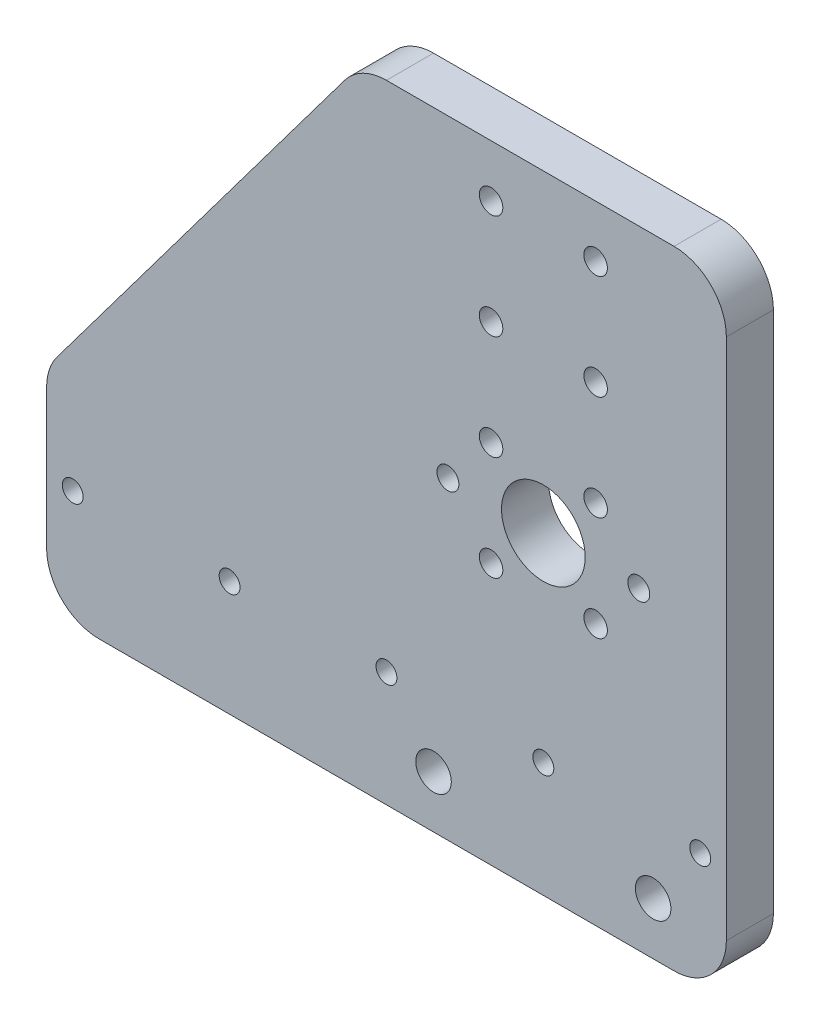
from build123d import *

# Parameters (mm, degrees)
BOSS_EXTRU_1_DEPTH      = 9
ESQUISSE2_R             = 2
ESQUISSE2_R_2           = 2.25
ENL_V_MAT_EXTRU_1_DEPTH = 178.146831753
ESQUISSE3_R             = 8
ESQUISSE3_R_2           = 3.4
ENL_V_MAT_EXTRU_2_DEPTH = 178.146831753
CONG_1_R                = 10
ESQUISSE6_R             = 2.1
ENL_V_MAT_EXTRU_4_DEPTH = 178.146831753


with BuildPart() as part:
    # Esquisse1 → Boss.-Extru.1 (new body)
    with BuildSketch(Plane.XY):
        Polygon((0, 0), (130, 0), (130, 120), (60, 120), (0, 40), align=None)
    extrude(amount=BOSS_EXTRU_1_DEPTH)

    # Esquisse2 → Enlèv. mat.-Extru.1 (cut, through all)
    with BuildSketch(Plane.XY.offset(9)):
        with Locations((65, 22)):
            Circle(ESQUISSE2_R)
        with Locations((35, 22)):
            Circle(ESQUISSE2_R)
        with Locations((5, 22)):
            Circle(ESQUISSE2_R)
        with Locations(Location((125, 22, 0), (0, 0, 180))):
            Circle(ESQUISSE2_R)
        with Locations(Location((95, 22, 0), (0, 0, 180))):
            Circle(ESQUISSE2_R)
        with Locations((85, 110)):
            Circle(ESQUISSE2_R_2)
        with Locations(Location((85, 90, 0), (0, 0, 180))):
            Circle(ESQUISSE2_R_2)
        with Locations((105, 90)):
            Circle(ESQUISSE2_R_2)
        with Locations(Location((105, 110, 0), (0, 0, 180))):
            Circle(ESQUISSE2_R_2)
        with Locations((105, 50)):
            Circle(ESQUISSE2_R_2)
        with Locations(Location((105, 70, 0), (0, 0, 180))):
            Circle(ESQUISSE2_R_2)
        with Locations((85, 70)):
            Circle(ESQUISSE2_R_2)
        with Locations(Location((85, 50, 0), (0, 0, 180))):
            Circle(ESQUISSE2_R_2)
    extrude(amount=-ENL_V_MAT_EXTRU_1_DEPTH, mode=Mode.SUBTRACT)

    # Esquisse3 → Enlèv. mat.-Extru.2 (cut, through all)
    with BuildSketch(Plane.XY.offset(9)):
        with Locations((95, 60)):
            Circle(ESQUISSE3_R)
        with Locations((74, 10)):
            Circle(ESQUISSE3_R_2)
        with Locations(Location((116, 10, 0), (0, 0, 180))):
            Circle(ESQUISSE3_R_2)
    extrude(amount=-ENL_V_MAT_EXTRU_2_DEPTH, mode=Mode.SUBTRACT)

    # Congé1
    cong_1_edges = [part.edges().sort_by_distance(p)[0] for p in [
        (0, 40, 4.5),
        (60, 120, 4.5),
        (130, 120, 4.5),
        (130, 0, 4.5),
        (0, 0, 4.5),
    ]]
    fillet(cong_1_edges, radius=CONG_1_R)

    # Esquisse6 → Enlèv. mat.-Extru.4 (cut, through all)
    with BuildSketch(Plane(origin=(0, 0, 0), x_dir=(-1, 0, 0), z_dir=(0, 0, -1))):
        with Locations((-113.25, 60)):
            Circle(ESQUISSE6_R)
        with Locations(Location((-76.75, 60, 0), (0, 0, 180))):
            Circle(ESQUISSE6_R)
    extrude(amount=-ENL_V_MAT_EXTRU_4_DEPTH, mode=Mode.SUBTRACT)


solid = part.part
